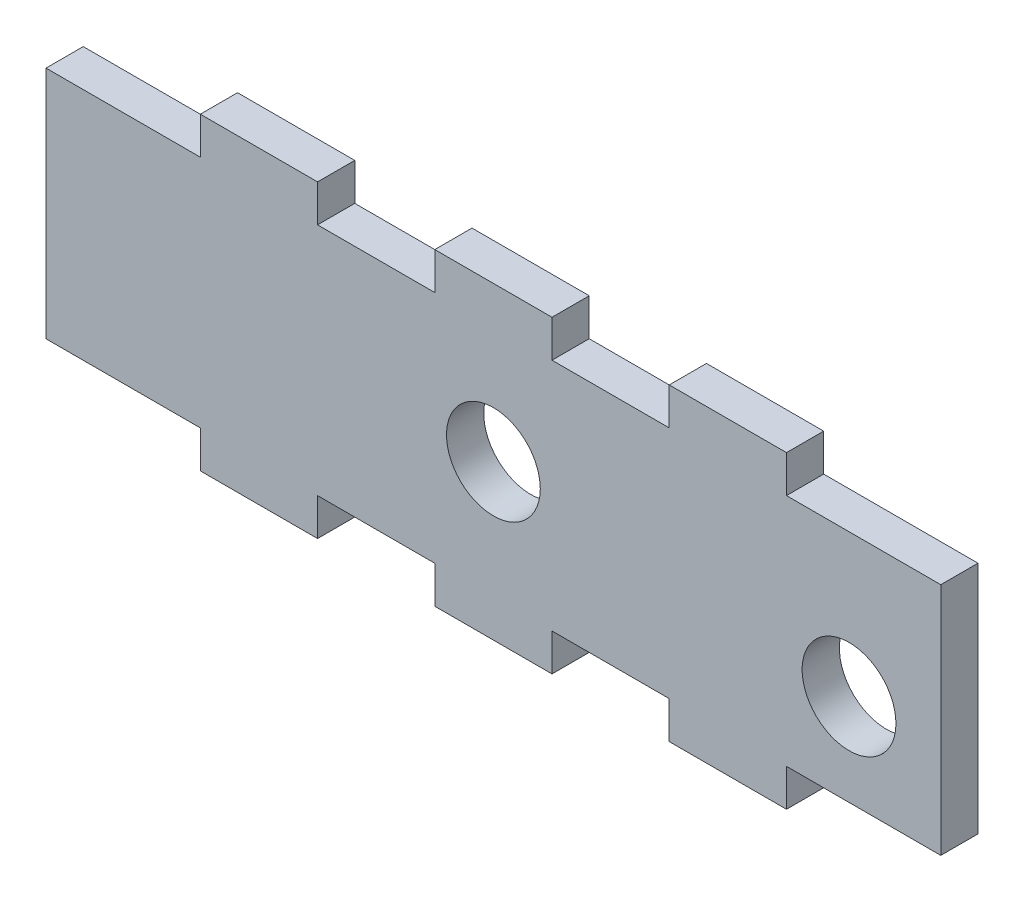
from build123d import *

# Parameters (mm, degrees)
ESQUISSE1_W             = 165.35
ESQUISSE1_H             = 52.7
BOSS_EXTRU_1_DEPTH      = 6.35
ESQUISSE5_W             = 20
ESQUISSE5_H             = 6.35
ESQUISSE5_W_2           = 26.325
ENL_V_MAT_EXTRU_2_DEPTH = 88.004601171
ESQUISSE7_W             = 6.35
ESQUISSE7_H             = 52.7
ENL_V_MAT_EXTRU_4_DEPTH = 88.004601171
ESQUISSE6_R             = 8
ENL_V_MAT_EXTRU_3_DEPTH = 81.994756775


with BuildPart() as part:
    # Esquisse1 → Boss.-Extru.1 (new body)
    with BuildSketch(Plane.XY):
        Rectangle(ESQUISSE1_W, ESQUISSE1_H)
    extrude(amount=BOSS_EXTRU_1_DEPTH)

    # Esquisse5 → Enlèv. mat.-Extru.2 (cut, through all)
    with BuildSketch(Plane.XY.offset(6.35)):
        with Locations((-20, -23.175)):
            Rectangle(ESQUISSE5_W, ESQUISSE5_H)
        with Locations((20, -23.175)):
            Rectangle(ESQUISSE5_W, ESQUISSE5_H)
        with Locations((63.1625, -23.175)):
            Rectangle(ESQUISSE5_W_2, ESQUISSE5_H)
        with Locations((-63.1625, -23.175)):
            Rectangle(ESQUISSE5_W_2, ESQUISSE5_H)
    enl_v_mat_extru_2 = extrude(amount=-ENL_V_MAT_EXTRU_2_DEPTH, mode=Mode.SUBTRACT)

    # Symétrie2: Enlèv. mat.-Extru.2 across plane
    add(enl_v_mat_extru_2.mirror(Plane.ZX), mode=Mode.SUBTRACT)

    # Esquisse7 → Enlèv. mat.-Extru.4 (cut, through all)
    with BuildSketch(Plane.XY.offset(6.35)):
        with Locations((-79.5, 0)):
            Rectangle(ESQUISSE7_W, ESQUISSE7_H)
        with Locations((79.5, 0)):
            Rectangle(ESQUISSE7_W, ESQUISSE7_H)
    extrude(amount=-ENL_V_MAT_EXTRU_4_DEPTH, mode=Mode.SUBTRACT)

    # Esquisse6 → Enlèv. mat.-Extru.3 (cut, through all)
    with BuildSketch(Plane.XY.offset(6.35)):
        Circle(ESQUISSE6_R)
        with Locations((60.675, -4.35)):
            Circle(ESQUISSE6_R)
    extrude(amount=-ENL_V_MAT_EXTRU_3_DEPTH, mode=Mode.SUBTRACT)


solid = part.part
